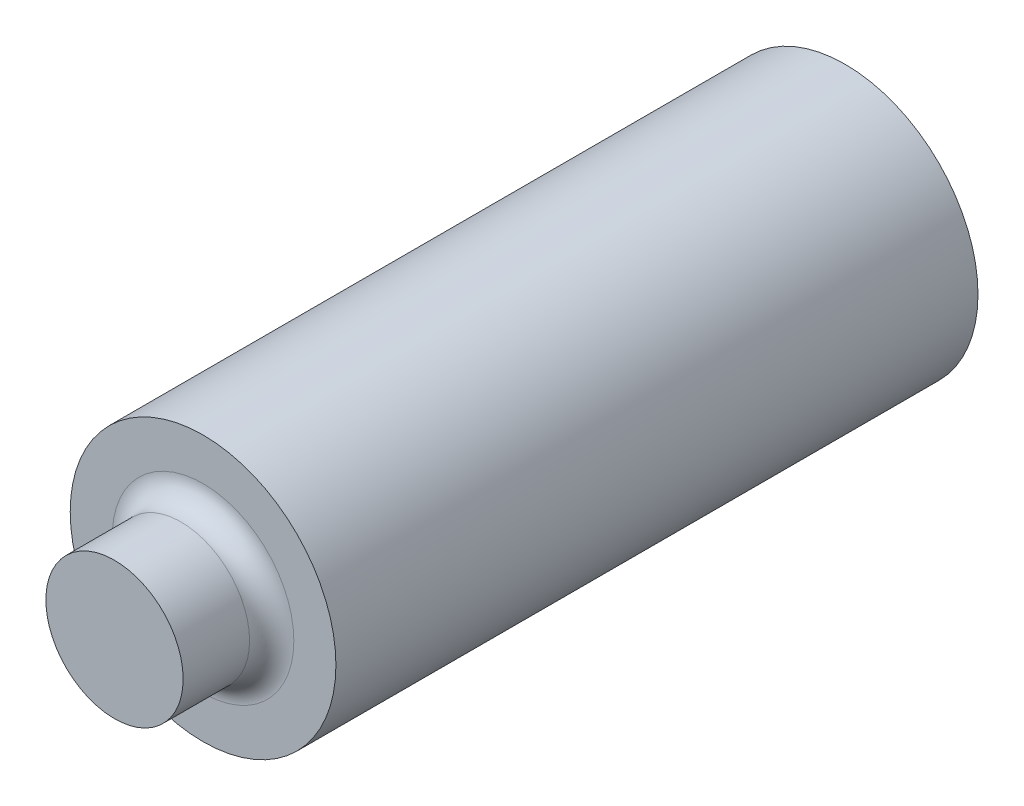
from build123d import *

# Parameters (mm, degrees)
SKETCH1_R           = 3
SKETCH1_R_2         = 1.55
BOSS_EXTRUDE1_DEPTH = 14.5
BOSS_EXTRUDE2_START = 14.5
SKETCH1_3_R         = 1.55
BOSS_EXTRUDE2_DEPTH = 2
FILLET1_R           = 0.5


with BuildPart() as part:
    # Sketch1 → Boss-Extrude1 (new body)
    # profile 1 of 2: a face of its own
    with BuildSketch(Plane.XY):
        with Locations(Location((0, 0, 0), (0, 0, 180))):
            Circle(SKETCH1_R)
        Circle(SKETCH1_R_2, mode=Mode.SUBTRACT)
    # profile 2 of 2: a face of its own
    with BuildSketch(Plane.XY):
        Circle(SKETCH1_R_2)
    extrude(amount=BOSS_EXTRUDE1_DEPTH)

    # Sketch1<3> → Boss-Extrude2 (add)
    with BuildSketch(Plane.XY.offset(BOSS_EXTRUDE2_START)):
        Circle(SKETCH1_3_R)
    extrude(amount=BOSS_EXTRUDE2_DEPTH)

    # Fillet1
    fillet1_edges = [part.edges().sort_by_distance(p)[0] for p in [
        (-1.55, 0, 14.5),
    ]]
    fillet(fillet1_edges, radius=FILLET1_R)


solid = part.part
